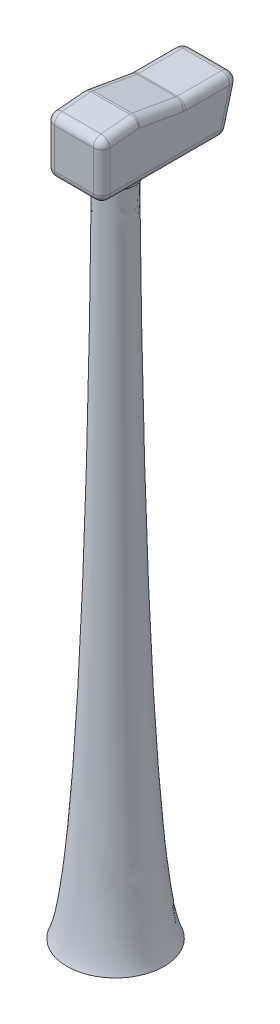
from build123d import *

# Parameters (mm, degrees)
AUFSATZ_LINEAR_AUSTRAGEN1_DEPTH      = 4000
AUFSATZ_LINEAR_AUSTRAGEN1_DEPTH_BACK = 4000
VERRUNDUNG1_R                        = 1200


with BuildPart() as part:
    # Skizze2 → Aufsatz-Linear austragen1 (new, two sides: drawn at the far end of the back side and taken through both)
    with BuildSketch(Plane(origin=(0, 0, 0), x_dir=(0, 0, -1), z_dir=(1, 0, 0)).offset(-AUFSATZ_LINEAR_AUSTRAGEN1_DEPTH_BACK)):
        Polygon((3000, -4000), (3000, 4000), (8400, 4472.43878304), (15000, 3308.680710364), (23000, 3308.680710364), (21041.644905921, -4000), align=None)
    extrude(amount=AUFSATZ_LINEAR_AUSTRAGEN1_DEPTH + AUFSATZ_LINEAR_AUSTRAGEN1_DEPTH_BACK)

    # Verrundung1
    verrundung1_edges = [part.edges().sort_by_distance(p)[0] for p in [
        (-4000, 3308.680710364, -19000),
        (0, 3308.680710364, -23000),
        (4000, 3308.680710364, -19000),
        (-4000, 3890.559746702, -11700),
        (0, 3308.680710364, -15000),
        (4000, 3890.559746702, -11700),
        (-4000, 4236.21939152, -5700),
        (0, 4472.43878304, -8400),
        (4000, 4236.21939152, -5700),
        (0, 4000, -3000),
        (0, -4000, -3000),
        (-4000, 0, -3000),
        (-4000, -4000, -12020.82245296),
        (-4000, -345.659644818, -22020.82245296),
        (0, -4000, -21041.644905921),
        (4000, -345.659644818, -22020.82245296),
        (4000, -4000, -12020.82245296),
        (4000, 0, -3000),
    ]]
    fillet(verrundung1_edges, radius=VERRUNDUNG1_R)

    # Skizze3 → Rotation1 (revolve)
    with BuildSketch(Plane(origin=(0, 0, 0), x_dir=(0, 0, -1), z_dir=(1, 0, 0))):
        with BuildLine():
            Line((6200, -2800), (9000, -2800))
            Line((9000, -2800), (9000, -100000))
            Line((9000, -100000), (2000, -100000))
            add(Edge.make_bspline(
                [(6520, -4800), (6520, -5632.504803687), (6182.478376426, -90939.906382547), (2000, -100000)],
                knots=[0, 0, 0, 0, 1, 1, 1, 1], degree=3))
            Line((6520, -4800), (6520, -4000))
            Line((6520, -4000), (6400, -4000))
            Line((6400, -4000), (6400, -4800))
            Line((6400, -4800), (6200, -4800))
            Line((6200, -4800), (6200, -2800))
        make_face()
    revolve(axis=Axis((0, 0, -9000), (0, -1, 0)))


solid = part.part
